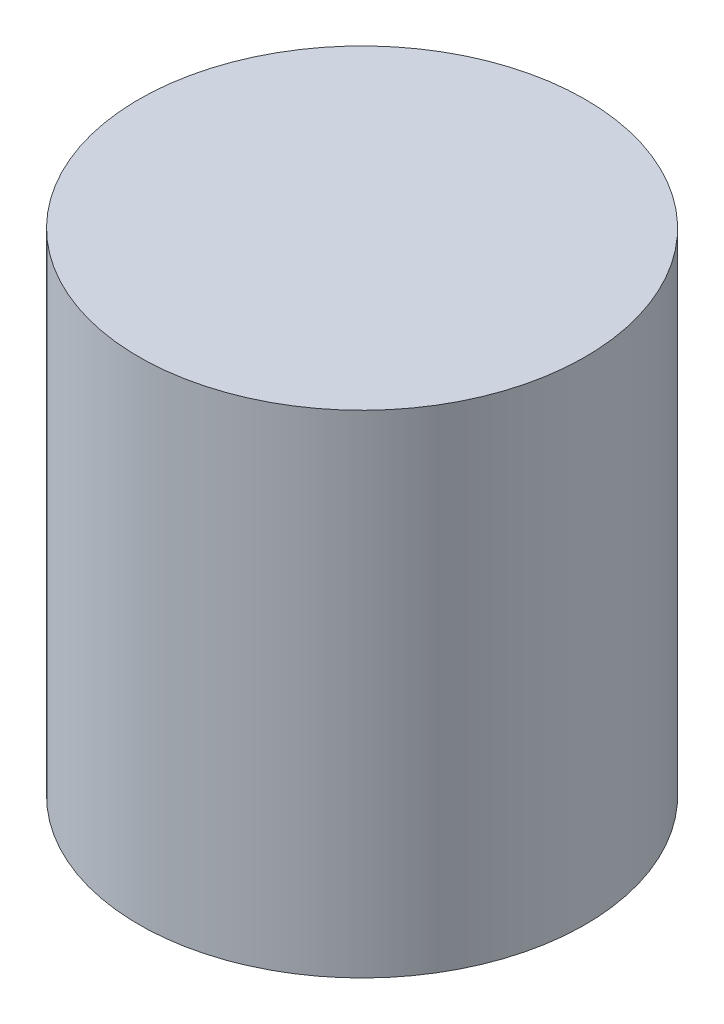
from build123d import *

# Parameters (mm, degrees)
SKETCH_1_R      = 2.95
EXTRUDE_2_DEPTH = 6.5


with BuildPart() as part:
    # 草图1 → 凸台-拉伸2 (new body)
    with BuildSketch(Plane(origin=(0, 0, 0), x_dir=(1, 0, 0), z_dir=(0, 1, 0))):
        with Locations(Location((-15.945819285, 10.601341392, 0), (0, 0, 90))):
            Circle(SKETCH_1_R)
    extrude(amount=EXTRUDE_2_DEPTH)


solid = part.part
